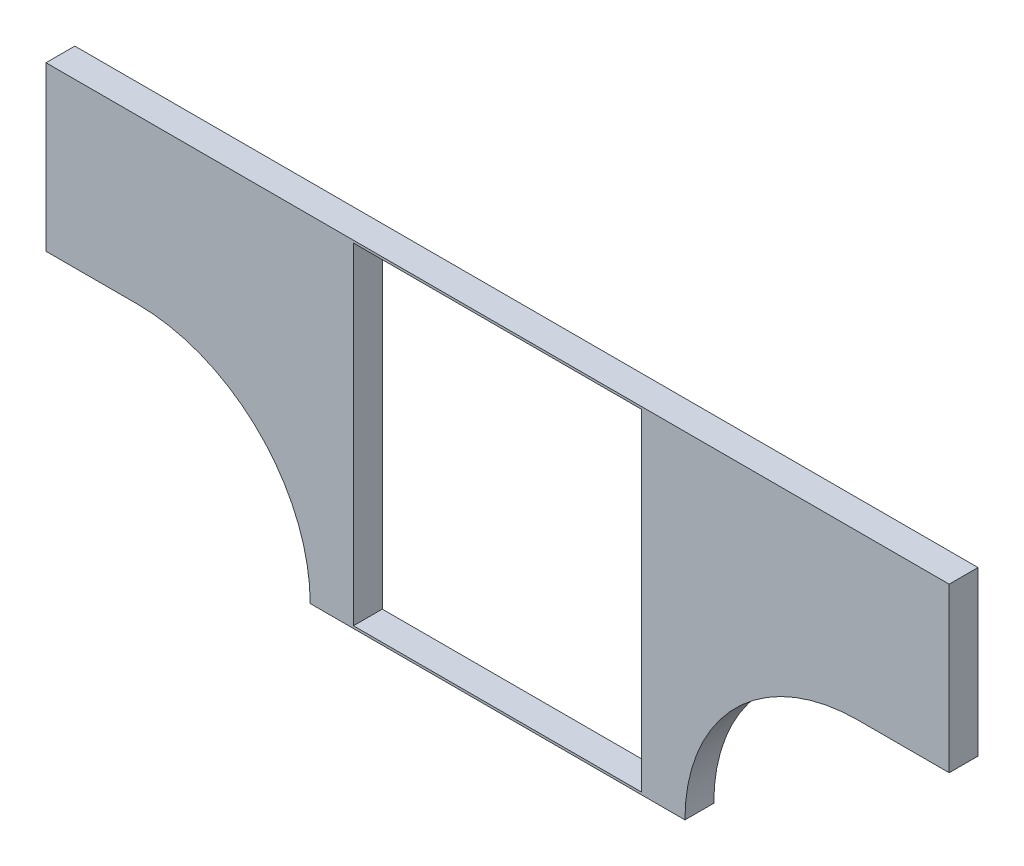
from build123d import *

# Parameters (mm, degrees)
BOSS_EXTRUDE1_DEPTH = 120
SKETCH2_W           = 1200
SKETCH2_H           = 1380
CUT_EXTRUDE1_DEPTH  = 120


with BuildPart() as part:
    # Sketch1 → Boss-Extrude1 (new body)
    with BuildSketch(Plane.XY):
        with BuildLine():
            ThreePointArc((780, -700), (990.883117546, -190.883117546), (1500, 20))
            Line((1500, 20), (1880, 20))
            Line((1880, 20), (1880, 700))
            Line((1880, 700), (-1880, 700))
            Line((-1880, 700), (-1880, 20))
            Line((-1880, 20), (-1500, 20))
            ThreePointArc((-1500, 20), (-990.883117546, -190.883117546), (-780, -700))
            Line((-780, -700), (780, -700))
        make_face()
    extrude(amount=BOSS_EXTRUDE1_DEPTH)

    # Sketch2 → Cut-Extrude1 (cut)
    with BuildSketch(Plane(origin=(0, 0, 0), x_dir=(-1, 0, 0), z_dir=(0, 0, -1))):
        Rectangle(SKETCH2_W, SKETCH2_H)
    extrude(amount=-CUT_EXTRUDE1_DEPTH, mode=Mode.SUBTRACT)


solid = part.part
